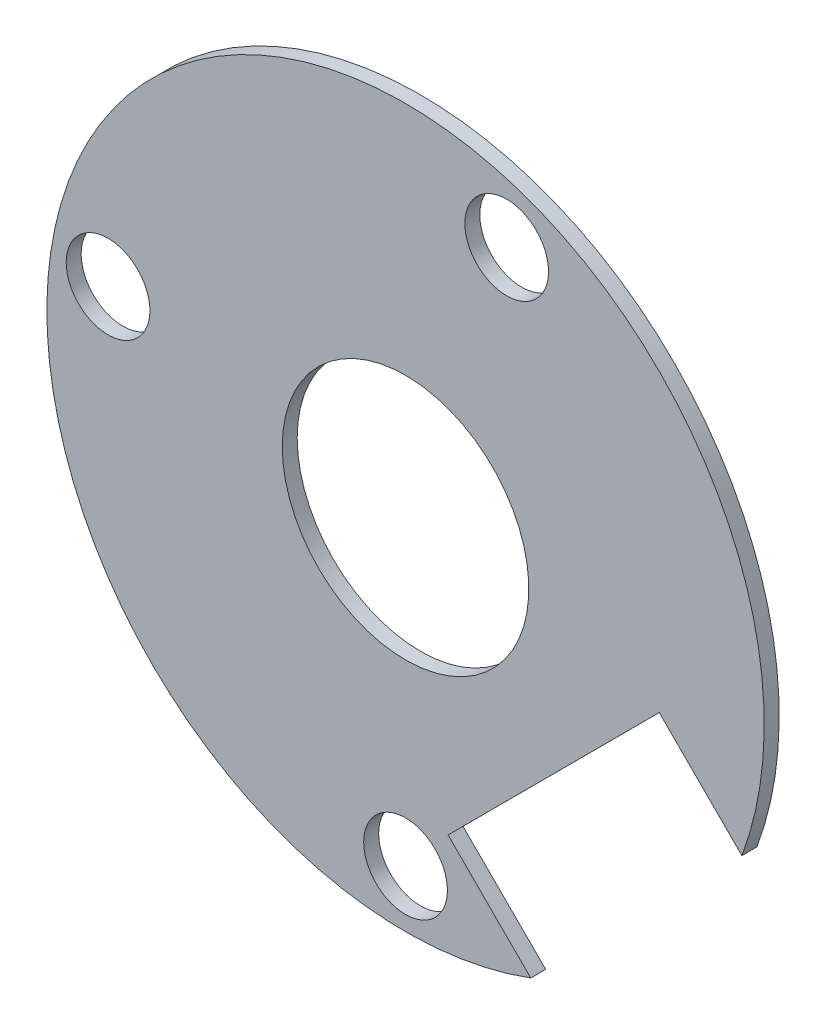
from build123d import *

# Parameters (mm, degrees)
SKETCH3_R               = 2.8
CUT_EXTRUDE2_DEPTH      = 3.25
CUT_EXTRUDE3_DEPTH      = 2
CUT_EXTRUDE4_DEPTH      = 188.637949253
CUT_EXTRUDE4_DEPTH_BACK = 188.637949253
SKETCH5_R               = 8.25
CUT_EXTRUDE5_DEPTH      = 115.087685576
CUT_EXTRUDE5_DEPTH_BACK = 115.087685576
SKETCH6_W               = 80.378885923
SKETCH6_H               = 187.007266033


with BuildPart() as part:
    # Sketch1 → Revolve1 (revolve)
    with BuildSketch(Plane(origin=(0, 0, 0), x_dir=(0, 0, -1), z_dir=(1, 0, 0)), mode=Mode.PRIVATE) as revolve1_sk:
        Polygon((-76, 0), (124.5, 0), (124.5, 4), (109, 4), (109, 8), (108, 8), (108, 24), (104, 24), (104, 25), (0, 25), (0, 26), (-50, 26), (-50, 9), (-52, 9), (-52, 6), (-76, 6), align=None)
    revolve(revolve1_sk.sketch.rotate(Axis((0, 0, 76), (0, 0, -1)), 180), axis=Axis((0, 0, 76), (0, 0, -1)))

    # Sketch3 → Cut-Extrude2 (cut)
    with BuildSketch(Plane.XY.offset(-108)):
        with Locations(Location((6.767859423, 19.032500593, 0), (0, 0, 180))):
            Circle(SKETCH3_R)
        with Locations(Location((-19.905985431, 3.433910891, 0), (0, 0, 180))):
            Circle(SKETCH3_R)
        with Locations(Location((0, -20.2, 0), (0, 0, 180))):
            Circle(SKETCH3_R)
    extrude(amount=CUT_EXTRUDE2_DEPTH, mode=Mode.SUBTRACT)

    # Sketch4 → Cut-Extrude3 (cut)
    with BuildSketch(Plane(origin=(0, 0, -108), x_dir=(-1, 0, 0), z_dir=(0, 0, -1))):
        Polygon((-22.506441861, -8.334271099), (-16.973308635, -2.811902197), (-2.844949371, -16.967800773), (-8.378082597, -22.490169675), (-11.338488517, -25.444816332), (-25.466847781, -11.288917756), align=None)
    extrude(amount=-CUT_EXTRUDE3_DEPTH, mode=Mode.SUBTRACT)

    # Sketch5 → Cut-Extrude4 (cut, two sides: drawn at the far end of the back side and taken through both)
    with BuildSketch(Plane(origin=(0, 0, -108), x_dir=(-1, 0, 0), z_dir=(0, 0, -1)).offset(-CUT_EXTRUDE4_DEPTH_BACK)):
        with Locations(Location((0, 0, 0), (0, 0, 90))):
            Circle(SKETCH5_R)
    extrude(amount=CUT_EXTRUDE4_DEPTH + CUT_EXTRUDE4_DEPTH_BACK, mode=Mode.SUBTRACT)

    # Sketch6 → Cut-Extrude5 (cut, two sides: drawn at the far end of the back side and taken through both)
    with BuildSketch(Plane(origin=(0, 0, 0), x_dir=(1, 0, 0), z_dir=(0, 1, 0)).offset(-CUT_EXTRUDE5_DEPTH_BACK)):
        with Locations((-2.527125216, 13.496366983)):
            Rectangle(SKETCH6_W, SKETCH6_H)
    extrude(amount=CUT_EXTRUDE5_DEPTH + CUT_EXTRUDE5_DEPTH_BACK, mode=Mode.SUBTRACT)


solid = part.part
